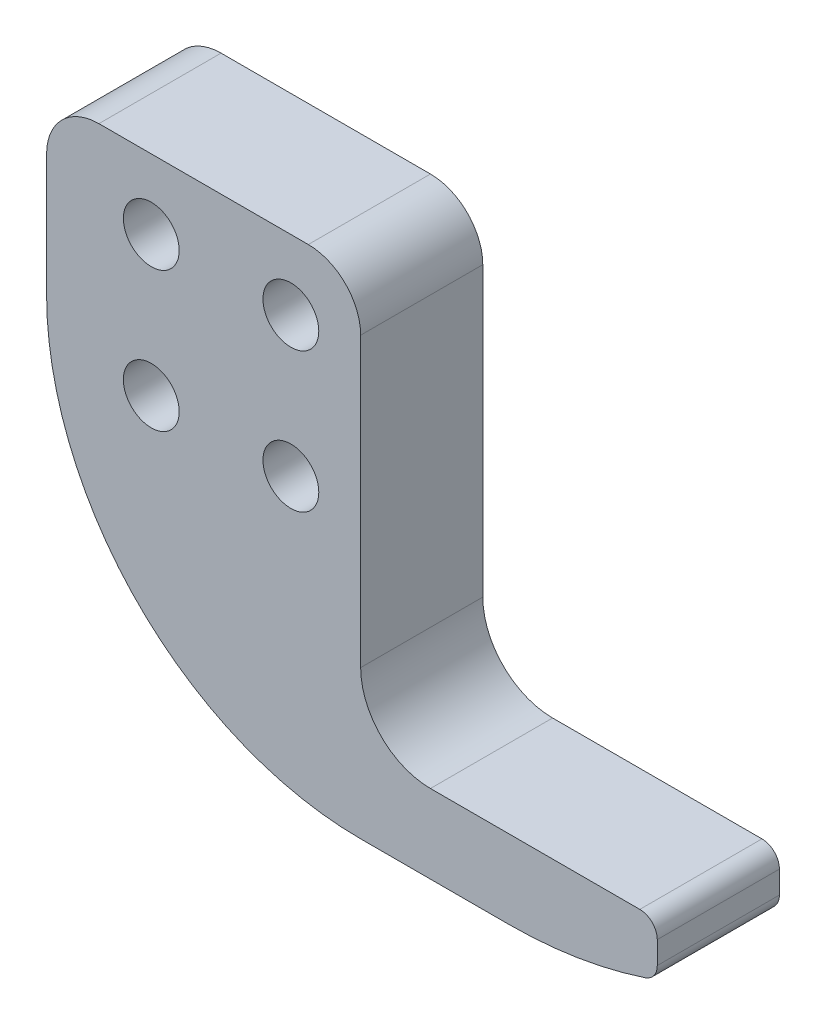
from build123d import *

# Parameters (mm, degrees)
EXTRUDE_1_DEPTH     = 3.5
SKETCH_3_R          = 1.6
CUT_EXTRUDE_1_DEPTH = 16
CUT_EXTRUDE_2_DEPTH = 13
FILLET_1_R          = 1
FILLET_2_R          = 3
FILLET_3_R          = 4


with BuildPart() as part:
    # 草图2 → 凸台-拉伸1 (new, symmetric)
    with BuildSketch(Plane.XY):
        with BuildLine():
            Line((-117.154590294, 76.5), (-117.154590294, 66.5))
            ThreePointArc((-117.154590294, 66.5), (-111.882512356, 53.772077939), (-99.154590294, 48.5))
            Line((-99.154590294, 48.5), (-82.154590294, 48.5))
            Line((-82.154590294, 48.5), (-82.154590294, 53))
            Line((-82.154590294, 53), (-99.154590294, 53))
            Line((-99.154590294, 53), (-99.154590294, 76.5))
            Line((-99.154590294, 76.5), (-117.154590294, 76.5))
        make_face()
    extrude(amount=EXTRUDE_1_DEPTH, both=True)

    # 草图3 → 切除-拉伸1 (cut)
    with BuildSketch(Plane.XY.offset(3.5)):
        with Locations((-103.154590294, 72.5)):
            Circle(SKETCH_3_R)
        with Locations((-111.154590294, 72.5)):
            Circle(SKETCH_3_R)
        with Locations((-111.154590294, 64.5)):
            Circle(SKETCH_3_R)
        with Locations((-103.154590294, 64.5)):
            Circle(SKETCH_3_R)
    extrude(amount=-CUT_EXTRUDE_1_DEPTH, mode=Mode.SUBTRACT)

    # 草图4 → 切除-拉伸2 (cut)
    with BuildSketch(Plane.XY.offset(3.5)):
        with BuildLine():
            Line((-90.683951349, 48.5), (-90.683951349, 46.627419574))
            Line((-90.683951349, 46.627419574), (-65.683951349, 46.627419574))
            Line((-65.683951349, 46.627419574), (-65.683951349, 73.5))
            ThreePointArc((-65.683951349, 73.5), (-73.006281819, 55.82233047), (-90.683951349, 48.5))
        make_face()
    extrude(amount=-CUT_EXTRUDE_2_DEPTH, mode=Mode.SUBTRACT)

    # 圆角1
    fillet_1_edges = [part.edges().sort_by_distance(p)[0] for p in [
        (-82.154590294, 53, 0),
        (-82.154590294, 50, 0),
    ]]
    fillet(fillet_1_edges, radius=FILLET_1_R)

    # 圆角2
    fillet_2_edges = [part.edges().sort_by_distance(p)[0] for p in [
        (-117.154590294, 76.5, 0),
        (-99.154590294, 76.5, 0),
    ]]
    fillet(fillet_2_edges, radius=FILLET_2_R)

    # 圆角3
    fillet_3_edges = [part.edges().sort_by_distance(p)[0] for p in [
        (-99.154590294, 53, 0),
    ]]
    fillet(fillet_3_edges, radius=FILLET_3_R)


solid = part.part
